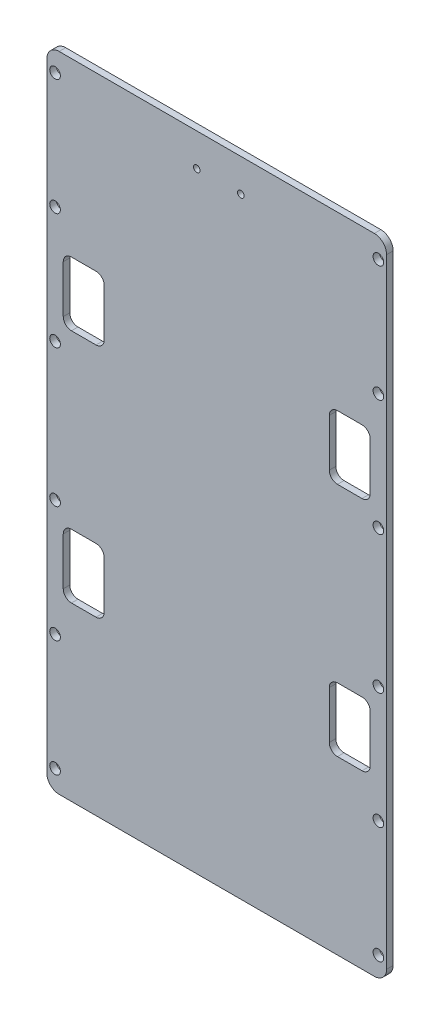
from build123d import *

# Parameters (mm, degrees)
GENERAL_SHAPE_DEPTH        = 1.6
M2_CLEARANCE_HOLE1_D       = 2.6
MIRROR2_COPY_1_D           = 2.6
SKETCH5_R                  = 0.8
CONNECTOR_HOLES_DEPTH      = 89.897525275
STAR_TRACKER_CUTOUTS_DEPTH = 89.897525275


with BuildPart() as part:
    # Sketch1 → General Shape (new body)
    with BuildSketch(Plane.XY):
        with BuildLine():
            Line((-38.5, 78.6), (38.5, 78.6))
            ThreePointArc((38.5, 78.6), (40.621320344, 77.721320344), (41.5, 75.6))
            Line((41.5, 75.6), (41.5, -75.6))
            ThreePointArc((41.5, -75.6), (40.621320344, -77.721320344), (38.5, -78.6))
            Line((38.5, -78.6), (-38.5, -78.6))
            ThreePointArc((-38.5, -78.6), (-40.621320344, -77.721320344), (-41.5, -75.6))
            Line((-41.5, -75.6), (-41.5, 75.6))
            ThreePointArc((-41.5, 75.6), (-40.621320344, 77.721320344), (-38.5, 78.6))
        make_face()
    extrude(amount=GENERAL_SHAPE_DEPTH)

    # M2 Clearance Hole1 (through all)
    with Locations(Plane(origin=(-39.5, 73.6, 0), x_dir=(-1, 0, 0), z_dir=(0, 0, -1))):
        with Locations((0, 0), (0, -28.4), (0, -56.8)):
            m2_clearance_hole1 = Hole(M2_CLEARANCE_HOLE1_D / 2)

    # Mirror1: M2 Clearance Hole1 across plane
    add(m2_clearance_hole1.mirror(Plane(origin=(0, 0, 0), x_dir=(0, 0, 1), z_dir=(1, 0, 0))), mode=Mode.SUBTRACT)

    # Mirror2: M2 Clearance Hole1 across plane
    add(m2_clearance_hole1.mirror(Plane.ZX), mode=Mode.SUBTRACT)

    # Mirror2 copy 1 (through all)
    with Locations(Plane(origin=(39.5, -73.6, 0), x_dir=(1, 0, 0), z_dir=(0, 0, -1))):
        with Locations((0, 0), (0, -28.4), (0, -56.8)):
            Hole(MIRROR2_COPY_1_D / 2)

    # Sketch5 → Connector holes (cut, through all)
    with BuildSketch(Plane(origin=(0, 0, 0), x_dir=(-1, 0, 0), z_dir=(0, 0, -1))):
        with Locations((-5.88, 70.6)):
            Circle(SKETCH5_R)
        with Locations((4.88, 70.6)):
            Circle(SKETCH5_R)
    extrude(amount=-CONNECTOR_HOLES_DEPTH, mode=Mode.SUBTRACT)

    # Sketch6 → Star Tracker Cutouts (cut, through all)
    with BuildSketch(Plane(origin=(0, 0, 0), x_dir=(-1, 0, 0), z_dir=(0, 0, -1))):
        with BuildLine():
            Line((-35.5, 36.6), (-29.5, 36.6))
            ThreePointArc((-29.5, 36.6), (-28.085786438, 36.014213562), (-27.5, 34.6))
            Line((-27.5, 34.6), (-27.5, 23))
            ThreePointArc((-27.5, 23), (-28.085786438, 21.585786438), (-29.5, 21))
            Line((-29.5, 21), (-35.5, 21))
            ThreePointArc((-35.5, 21), (-36.914213562, 21.585786438), (-37.5, 23))
            Line((-37.5, 23), (-37.5, 34.6))
            ThreePointArc((-37.5, 34.6), (-36.914213562, 36.014213562), (-35.5, 36.6))
        make_face()
        with BuildLine():
            Line((29.5, 36.6), (35.5, 36.6))
            ThreePointArc((35.5, 36.6), (36.914213562, 36.014213562), (37.5, 34.6))
            Line((37.5, 34.6), (37.5, 23))
            ThreePointArc((37.5, 23), (36.914213562, 21.585786438), (35.5, 21))
            Line((35.5, 21), (29.5, 21))
            ThreePointArc((29.5, 21), (28.085786438, 21.585786438), (27.5, 23))
            Line((27.5, 23), (27.5, 34.6))
            ThreePointArc((27.5, 34.6), (28.085786438, 36.014213562), (29.5, 36.6))
        make_face()
        with BuildLine():
            Line((-35.5, -21), (-29.5, -21))
            ThreePointArc((-29.5, -21), (-28.085786438, -21.585786438), (-27.5, -23))
            Line((-27.5, -23), (-27.5, -34.6))
            ThreePointArc((-27.5, -34.6), (-28.085786438, -36.014213562), (-29.5, -36.6))
            Line((-29.5, -36.6), (-35.5, -36.6))
            ThreePointArc((-35.5, -36.6), (-36.914213562, -36.014213562), (-37.5, -34.6))
            Line((-37.5, -34.6), (-37.5, -23))
            ThreePointArc((-37.5, -23), (-36.914213562, -21.585786438), (-35.5, -21))
        make_face()
        with BuildLine():
            Line((29.5, -21), (35.5, -21))
            ThreePointArc((35.5, -21), (36.914213562, -21.585786438), (37.5, -23))
            Line((37.5, -23), (37.5, -34.6))
            ThreePointArc((37.5, -34.6), (36.914213562, -36.014213562), (35.5, -36.6))
            Line((35.5, -36.6), (29.5, -36.6))
            ThreePointArc((29.5, -36.6), (28.085786438, -36.014213562), (27.5, -34.6))
            Line((27.5, -34.6), (27.5, -23))
            ThreePointArc((27.5, -23), (28.085786438, -21.585786438), (29.5, -21))
        make_face()
    extrude(amount=-STAR_TRACKER_CUTOUTS_DEPTH, mode=Mode.SUBTRACT)


solid = part.part
